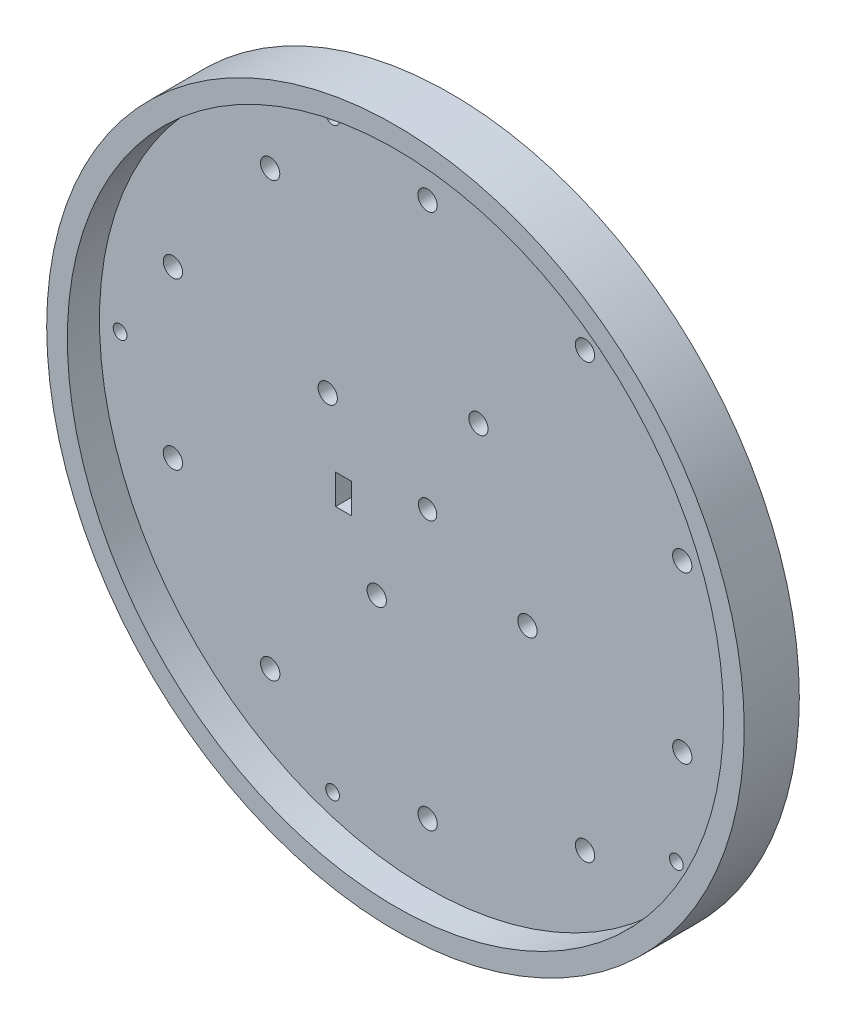
from build123d import *

# Parameters (mm, degrees)
ESQUISSE1_R             = 76
BOSS_EXTRU_1_DEPTH      = 5
ESQUISSE2_R             = 2.1
ENL_V_MAT_EXTRU_1_DEPTH = 10
ESQUISSE4_R             = 1.5
ESQUISSE4_R_2           = 2
ENL_V_MAT_EXTRU_2_DEPTH = 10
ESQUISSE5_R             = 76
ESQUISSE5_R_2           = 68.5
BOSS_EXTRU_2_DEPTH      = 7
ESQUISSE6_R             = 4.5
ENL_V_MAT_EXTRU_3_DEPTH = 7
ESQUISSE7_R             = 71.5
ENL_V_MAT_EXTRU_4_DEPTH = 7
ESQUISSE8_W             = 3.5
ESQUISSE8_H             = 6.5
ENL_V_MAT_EXTRU_5_DEPTH = 4
ESQUISSE10_R            = 2.55
ENL_V_MAT_EXTRU_6_DEPTH = 4


with BuildPart() as part:
    # Esquisse1 → Boss.-Extru.1 (new body)
    with BuildSketch(Plane.XY):
        Circle(ESQUISSE1_R)
    extrude(amount=BOSS_EXTRU_1_DEPTH)

    # Esquisse2 → Enlèv. mat.-Extru.1 (cut)
    with BuildSketch(Plane.XY.offset(5)):
        with Locations((-55.497382355, 18.021183418)):
            Circle(ESQUISSE2_R)
        with Locations((-34.305739626, 47.199986533)):
            Circle(ESQUISSE2_R)
        with Locations((-0.010470369, 58.349999061)):
            Circle(ESQUISSE2_R)
        with Locations((34.288798212, 47.212295191)):
            Circle(ESQUISSE2_R)
        with Locations((55.49091131, 18.041099245)):
            Circle(ESQUISSE2_R)
        with Locations((55.497382355, -18.021183418)):
            Circle(ESQUISSE2_R)
        with Locations((34.305739626, -47.199986533)):
            Circle(ESQUISSE2_R)
        with Locations((0.010470369, -58.349999061)):
            Circle(ESQUISSE2_R)
        with Locations((-34.288798212, -47.212295191)):
            Circle(ESQUISSE2_R)
        with Locations((-55.49091131, -18.041099245)):
            Circle(ESQUISSE2_R)
        with Locations((-11.082204515, -21.759702771)):
            Circle(ESQUISSE2_R)
        with Locations((-21.759702771, 11.082204515)):
            Circle(ESQUISSE2_R)
        with Locations((11.082204515, 21.759702771)):
            Circle(ESQUISSE2_R)
        with Locations((21.759702771, -11.082204515)):
            Circle(ESQUISSE2_R)
    extrude(amount=-ENL_V_MAT_EXTRU_1_DEPTH, mode=Mode.SUBTRACT)

    # Esquisse4 → Enlèv. mat.-Extru.2 (cut)
    with BuildSketch(Plane.XY.offset(5)):
        with Locations((-20.704138623, -63.720786592)):
            Circle(ESQUISSE4_R)
        with Locations((-67, 0)):
            Circle(ESQUISSE4_R)
        with Locations((-20.704138623, 63.720786592)):
            Circle(ESQUISSE4_R)
        with Locations((54.204138623, 39.381611904)):
            Circle(ESQUISSE4_R)
        with Locations((54.204138623, -39.381611904)):
            Circle(ESQUISSE4_R)
        Circle(ESQUISSE4_R_2)
    extrude(amount=-ENL_V_MAT_EXTRU_2_DEPTH, mode=Mode.SUBTRACT)

    # Esquisse5 → Boss.-Extru.2 (add)
    with BuildSketch(Plane.XY.offset(5)):
        Circle(ESQUISSE5_R)
        with Locations(Location((0, 0, 0), (0, 0, 179.999985351))):
            Circle(ESQUISSE5_R_2, mode=Mode.SUBTRACT)
    extrude(amount=BOSS_EXTRU_2_DEPTH)

    # Esquisse6 → Enlèv. mat.-Extru.3 (cut)
    with BuildSketch(Plane.XY.offset(12)):
        with Locations((-20.704138623, 63.720786592)):
            Circle(ESQUISSE6_R)
        with Locations((54.204138623, 39.381611904)):
            Circle(ESQUISSE6_R)
        with Locations((54.204138623, -39.381611904)):
            Circle(ESQUISSE6_R)
        with Locations((-20.704138623, -63.720786592)):
            Circle(ESQUISSE6_R)
        with Locations((-67, 0)):
            Circle(ESQUISSE6_R)
    extrude(amount=-ENL_V_MAT_EXTRU_3_DEPTH, mode=Mode.SUBTRACT)

    # Esquisse7 → Enlèv. mat.-Extru.4 (cut)
    with BuildSketch(Plane.XY.offset(12)):
        Circle(ESQUISSE7_R)
    extrude(amount=-ENL_V_MAT_EXTRU_4_DEPTH, mode=Mode.SUBTRACT)

    # Esquisse8 → Enlèv. mat.-Extru.5 (cut)
    with BuildSketch(Plane.XY.offset(5)):
        with Locations((-18.309702771, -6.25)):
            Rectangle(ESQUISSE8_W, ESQUISSE8_H)
    extrude(amount=-ENL_V_MAT_EXTRU_5_DEPTH, mode=Mode.SUBTRACT)

    # Esquisse10 → Enlèv. mat.-Extru.6 (cut)
    with BuildSketch(Plane(origin=(0, 0, 0), x_dir=(-1, 0, 0), z_dir=(0, 0, -1))):
        with Locations((-67, 0)):
            Circle(ESQUISSE10_R)
    extrude(amount=-ENL_V_MAT_EXTRU_6_DEPTH, mode=Mode.SUBTRACT)


solid = part.part
